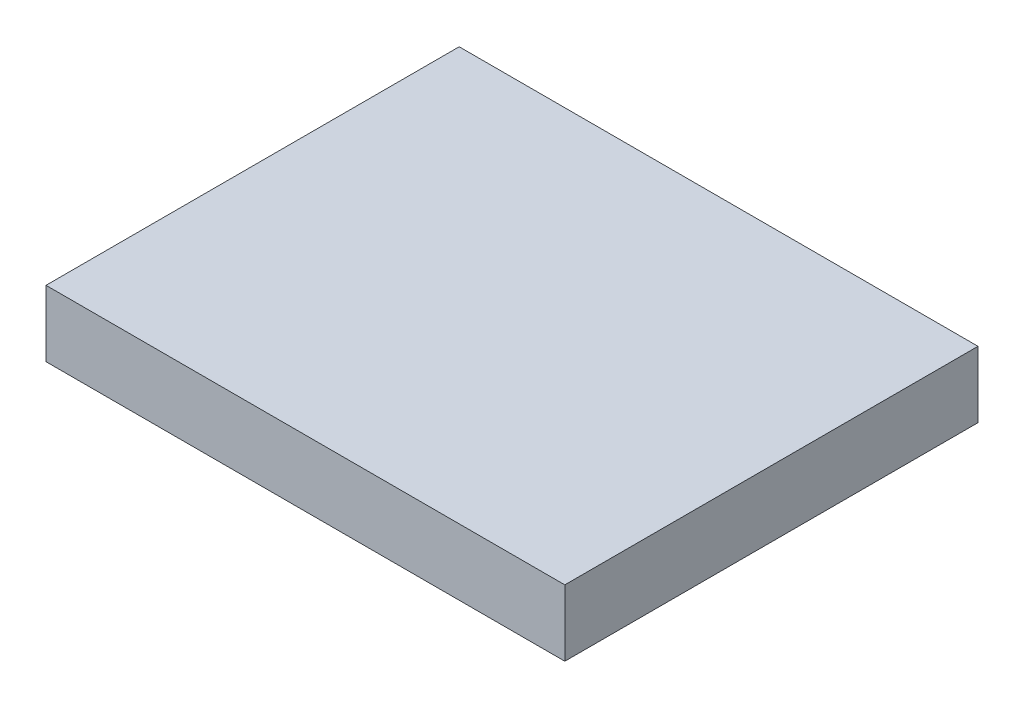
from build123d import *

# Parameters (mm, degrees)
SKETCH1_W           = 424.18
SKETCH1_H           = 337.82
BOSS_EXTRUDE1_DEPTH = 54.102


with BuildPart() as part:
    # Sketch1 → Boss-Extrude1 (new body)
    with BuildSketch(Plane(origin=(0, 0, 0), x_dir=(1, 0, 0), z_dir=(0, 1, 0))):
        with Locations((212.09, 168.91)):
            Rectangle(SKETCH1_W, SKETCH1_H)
    extrude(amount=BOSS_EXTRUDE1_DEPTH)


solid = part.part
